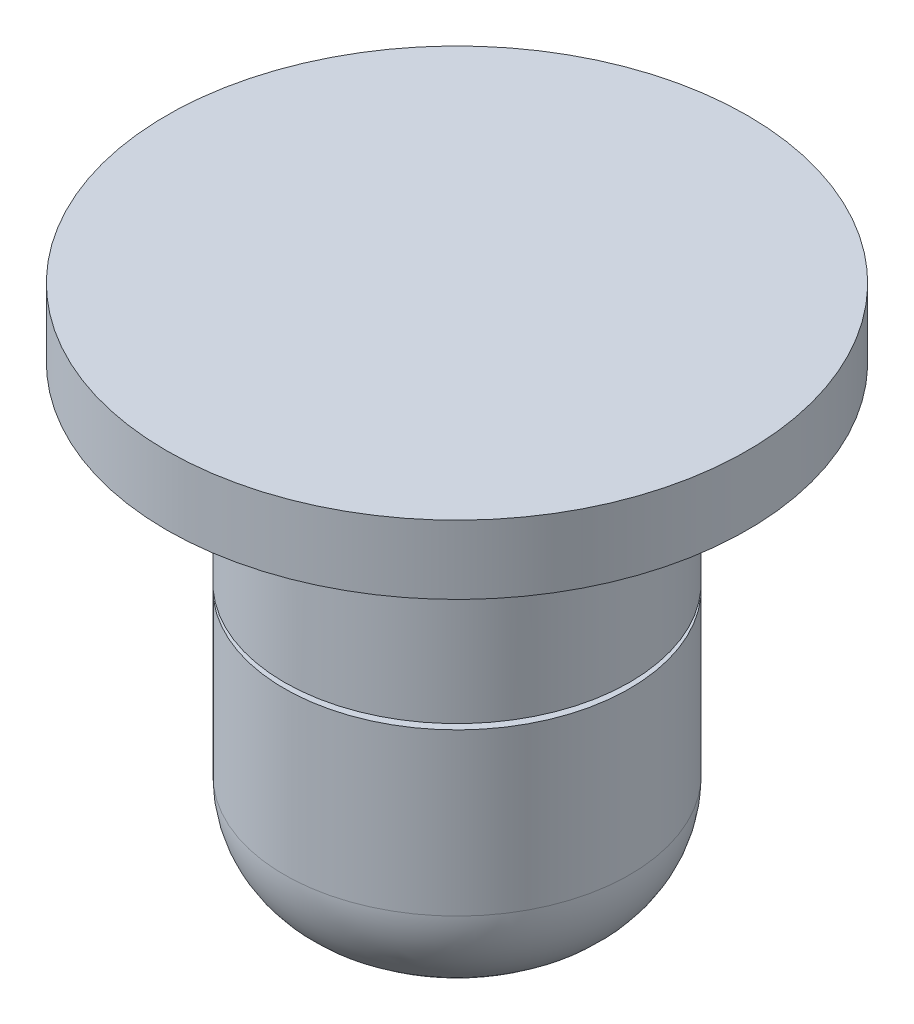
from build123d import *

# Parameters (mm, degrees)
CUT_EXTRUDE1_DEPTH      = 18.972000794
CUT_EXTRUDE1_DEPTH_BACK = 18.972000794
SKETCH2_W               = 72.831256038
SKETCH2_H               = 0.2


with BuildPart() as part:
    # Sketch1 → Revolve1 (revolve)
    with BuildSketch(Plane.XY, mode=Mode.PRIVATE) as revolve1_sk:
        with BuildLine():
            Line((0, 9.740928594), (10.679586151, 9.740928594))
            Line((10.679586151, 9.740928594), (10.679586151, 7.215801682))
            Line((10.679586151, 7.215801682), (6.35, 7.215801682))
            Line((6.35, 7.215801682), (6.35, -5.930928594))
            ThreePointArc((6.35, -5.930928594), (5.234076836, -8.625005431), (2.54, -9.740928594))
            Line((2.54, -9.740928594), (0, -9.740928594))
            Line((0, -9.740928594), (0, 9.740928594))
        make_face()
    revolve(revolve1_sk.sketch.rotate(Axis((0, -9.740928594, 0), (0, 1, 0)), 90), axis=Axis((0, -9.740928594, 0), (0, 1, 0)))

    # Sketch2 → Cut-Extrude1 (cut, two sides: drawn at the far end of the back side and taken through both)
    with BuildSketch(Plane.XY.offset(-CUT_EXTRUDE1_DEPTH_BACK)):
        with Locations((0, 0.1)):
            Rectangle(SKETCH2_W, SKETCH2_H)
    extrude(amount=CUT_EXTRUDE1_DEPTH + CUT_EXTRUDE1_DEPTH_BACK, mode=Mode.SUBTRACT)


with BuildPart() as cut_extrude1_piece_1:
    # of the separate pieces the step leaves, piece 1, a body of its own (cut_extrude1_pieces)
    add(part.part.solids().sort_by_distance((0, 7.215801682, -6.35))[0])


with BuildPart() as cut_extrude1_piece_2:
    # of the separate pieces the step leaves, piece 2, a body of its own (cut_extrude1_pieces)
    add(part.part.solids().sort_by_distance((0, -9.740928594, -2.54))[0])


solid = Compound([cut_extrude1_piece_1.part, cut_extrude1_piece_2.part])
